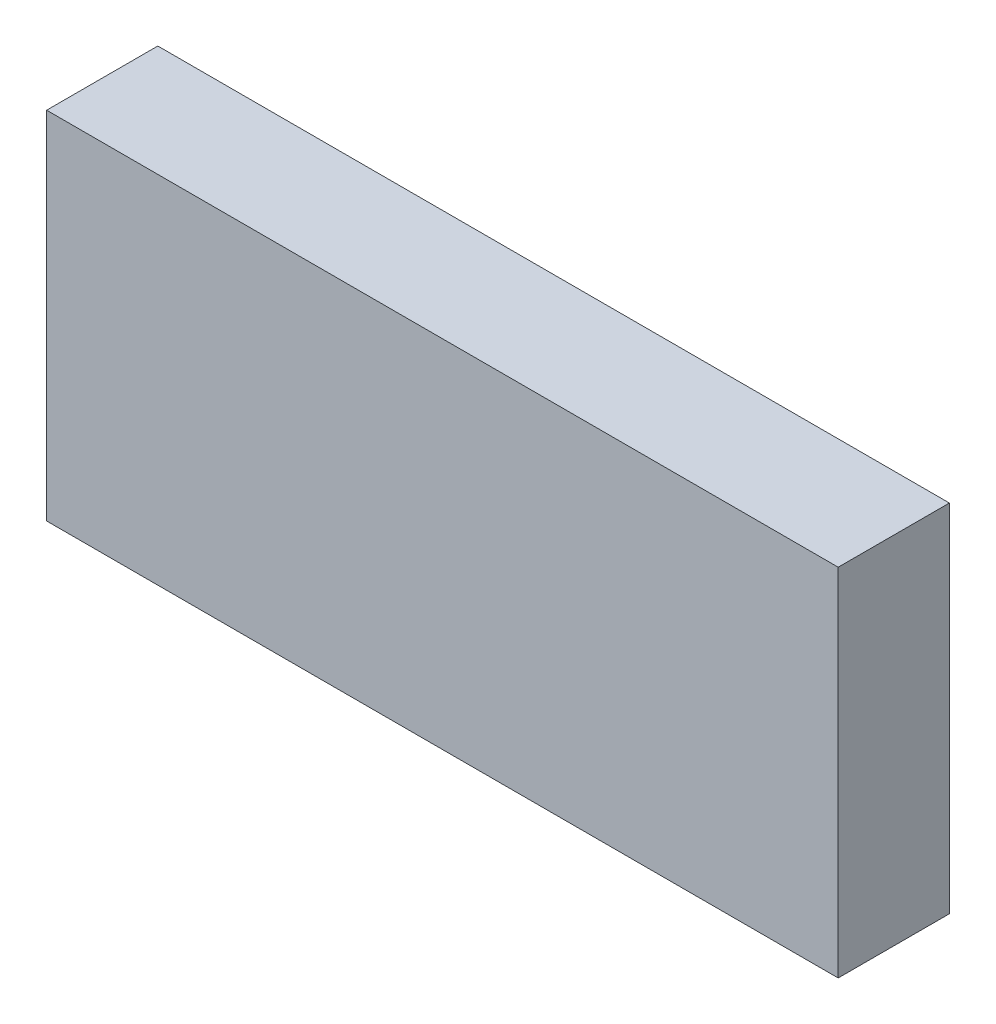
from build123d import *

# Parameters (mm, degrees)
SKETCH1_W           = 11.303
SKETCH1_H           = 5.08
BOSS_EXTRUDE1_DEPTH = 1.5875


with BuildPart() as part:
    # Sketch1 → Boss-Extrude1 (new body)
    with BuildSketch(Plane.XY):
        with Locations((-12.7, -109.4105)):
            Rectangle(SKETCH1_W, SKETCH1_H)
    extrude(amount=BOSS_EXTRUDE1_DEPTH)


solid = part.part
